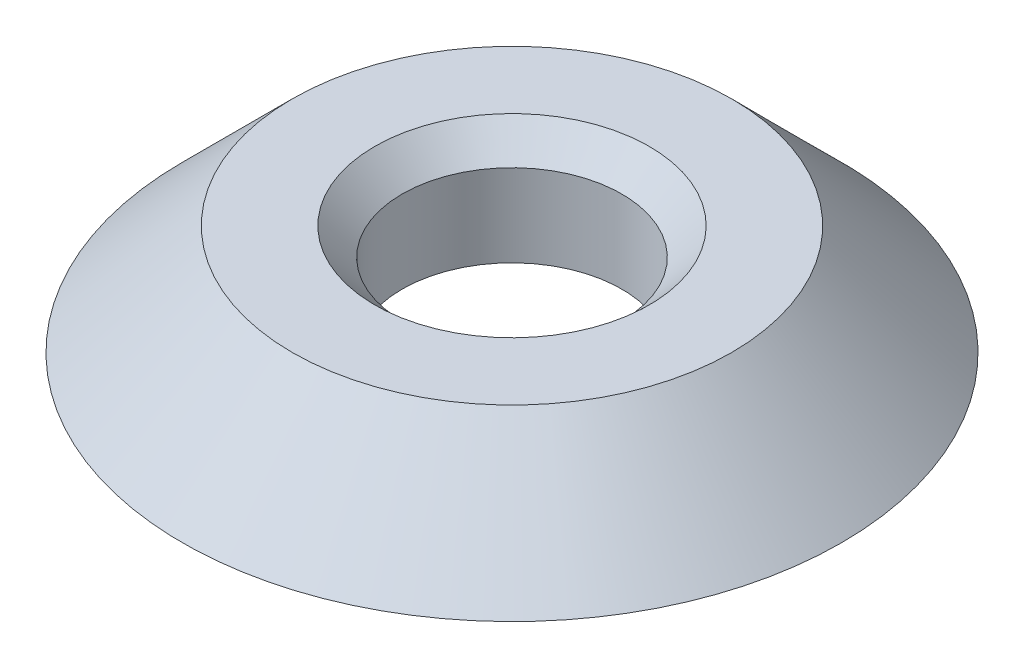
from build123d import *

# Parameters (mm, degrees)
CHAMFER1_SIZE = 0.5


with BuildPart() as part:
    # Sketch1 → Revolve1 (revolve)
    with BuildSketch(Plane.XY):
        Polygon((2, 0), (2, 2), (4, 2), (6, 0), align=None)
    revolve(axis=Axis((0, -795.727916551, 0), (0, 1, 0)))

    # Chamfer1
    chamfer1_edges = [part.edges().sort_by_distance(p)[0] for p in [
        (-2, 2, 0),
    ]]
    chamfer(chamfer1_edges, length=CHAMFER1_SIZE)


solid = part.part
